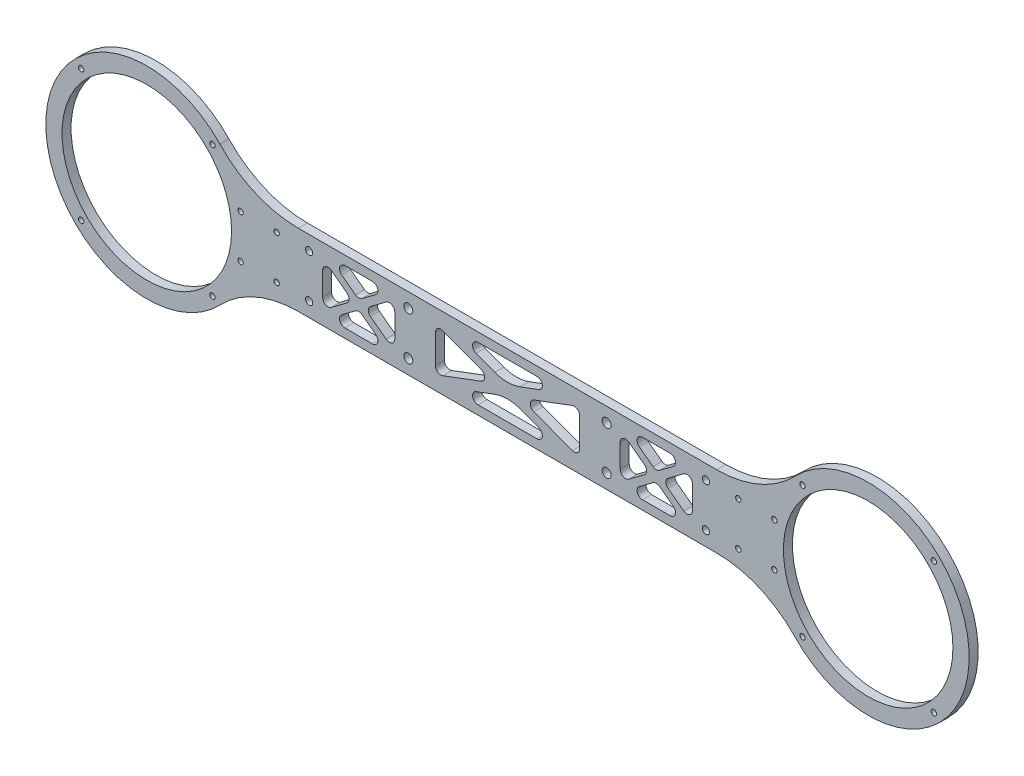
from build123d import *

# Parameters (mm, degrees)
SKETCH_1_R           = 47
EXTRUDE_1_DEPTH      = 5
FILLET_1_R           = 60
SKETCH_31_R          = 1.5
CUT_EXTRUDE_14_DEPTH = 5
SKETCH_35_R          = 2.5
SKETCH_35_R_2        = 2
CUT_EXTRUDE_17_DEPTH = 10
CUT_EXTRUDE_18_DEPTH = 10
FILLET_2_R           = 3
FILLET_3_R           = 20
CUT_EXTRUDE_19_DEPTH = 10
SKETCH_39_R          = 1.5
CUT_EXTRUDE_20_DEPTH = 10
FILLET_4_R           = 3


with BuildPart() as part:
    # 草图1 → 凸台-拉伸1 (new body)
    with BuildSketch(Plane.XY):
        with BuildLine():
            Line((347.693212678, 20), (52.306787322, 20))
            ThreePointArc((52.306787322, 20), (-56, 0), (52.306787322, -20))
            Line((52.306787322, -20), (347.693212678, -20))
            ThreePointArc((347.693212678, -20), (456, 0), (347.693212678, 20))
        make_face()
        Circle(SKETCH_1_R, mode=Mode.SUBTRACT)
        with Locations((400, 0)):
            Circle(SKETCH_1_R, mode=Mode.SUBTRACT)
    extrude(amount=EXTRUDE_1_DEPTH)

    # 圆角1
    fillet_1_edges = [part.edges().sort_by_distance(p)[0] for p in [
        (347.693212678, -20, 2.5),
        (52.306787322, -20, 2.5),
        (52.306787322, 20, 2.5),
        (347.693212678, 20, 2.5),
    ]]
    fillet(fillet_1_edges, radius=FILLET_1_R)

    # 草图31 → 切除-拉伸14 (cut)
    with BuildSketch(Plane.XY.offset(5)):
        with Locations((36.415999231, 36.415999231)):
            Circle(SKETCH_31_R)
        with Locations((36.415999231, -36.415999231)):
            Circle(SKETCH_31_R)
        with Locations((-36.415999231, -36.415999231)):
            Circle(SKETCH_31_R)
        with Locations((-36.415999231, 36.415999231)):
            Circle(SKETCH_31_R)
        with Locations((436.415999231, 36.415999231)):
            Circle(SKETCH_31_R)
        with Locations((436.415999231, -36.415999231)):
            Circle(SKETCH_31_R)
        with Locations((363.584000769, -36.415999231)):
            Circle(SKETCH_31_R)
        with Locations((363.584000769, 36.415999231)):
            Circle(SKETCH_31_R)
    extrude(amount=-CUT_EXTRUDE_14_DEPTH, mode=Mode.SUBTRACT)

    # 草图35 → 切除-拉伸17 (cut)
    with BuildSketch(Plane.XY.offset(5)):
        with Locations((145, 12)):
            Circle(SKETCH_35_R)
        with Locations((255, 12)):
            Circle(SKETCH_35_R)
        with Locations((145, -12)):
            Circle(SKETCH_35_R)
        with Locations((255, -12)):
            Circle(SKETCH_35_R)
        with Locations((90, -12)):
            Circle(SKETCH_35_R_2)
        with Locations((90, 12)):
            Circle(SKETCH_35_R_2)
        with Locations((310, -12)):
            Circle(SKETCH_35_R_2)
        with Locations((310, 12)):
            Circle(SKETCH_35_R_2)
    extrude(amount=-CUT_EXTRUDE_17_DEPTH, mode=Mode.SUBTRACT)

    # 草图37 → 切除-拉伸18 (cut)
    with BuildSketch(Plane(origin=(0, 0, 0), x_dir=(-1, 0, 0), z_dir=(0, 0, -1))):
        Polygon((-232.879996879, 15), (-200, 2.67000117), (-167.120003121, 15), align=None)
        Polygon((-160, 12.32999883), (-192.879996879, 0), (-160, -12.32999883), align=None)
        Polygon((-167.120003121, -15), (-200, -2.67000117), (-232.879996879, -15), align=None)
        Polygon((-240, 12.32999883), (-240, -12.32999883), (-207.120003121, 0), align=None)
    extrude(amount=-CUT_EXTRUDE_18_DEPTH, mode=Mode.SUBTRACT)

    # 圆角2
    fillet_2_edges = [part.edges().sort_by_distance(p)[0] for p in [
        (167.120003121, -15, 2.5),
        (232.879996879, -15, 2.5),
        (192.879996879, 0, 2.5),
        (160, 12.32999883, 2.5),
        (160, -12.32999883, 2.5),
        (240, 12.32999883, 2.5),
        (207.120003121, 0, 2.5),
        (240, -12.32999883, 2.5),
        (232.879996879, 15, 2.5),
        (167.120003121, 15, 2.5),
    ]]
    fillet(fillet_2_edges, radius=FILLET_2_R)

    # 圆角3
    fillet_3_edges = [part.edges().sort_by_distance(p)[0] for p in [
        (200, -2.67000117, 2.5),
        (200, 2.67000117, 2.5),
    ]]
    fillet(fillet_3_edges, radius=FILLET_3_R)

    # 草图38 → 切除-拉伸19 (cut)
    with BuildSketch(Plane(origin=(0, 0, 0), x_dir=(-1, 0, 0), z_dir=(0, 0, -1))):
        Polygon((-302.5, 12.5), (-302.5, -12.5), (-285.833333333, 0), align=None)
        Polygon((-262.5, 12.5), (-279.166666667, 0), (-262.5, -12.5), align=None)
        Polygon((-265.833333333, -15), (-282.5, -2.5), (-299.166666667, -15), align=None)
        Polygon((-299.166666667, 15), (-282.5, 2.5), (-265.833333333, 15), align=None)
        Polygon((-100.833333333, -15), (-117.5, -2.5), (-134.166666667, -15), align=None)
        Polygon((-97.5, 12.5), (-114.166666667, 0), (-97.5, -12.5), align=None)
        Polygon((-117.5, 2.5), (-100.833333333, 15), (-134.166666667, 15), align=None)
        Polygon((-137.5, -12.5), (-120.833333333, 0), (-137.5, 12.5), align=None)
    extrude(amount=-CUT_EXTRUDE_19_DEPTH, mode=Mode.SUBTRACT)

    # 草图39 → 切除-拉伸20 (cut)
    with BuildSketch(Plane.XY.offset(5)):
        with Locations((72.001998462, -12)):
            Circle(SKETCH_39_R)
        with Locations((52, -12)):
            Circle(SKETCH_39_R)
        with Locations((72.001998462, 12)):
            Circle(SKETCH_39_R)
        with Locations((52, 12)):
            Circle(SKETCH_39_R)
        with Locations((348, 12)):
            Circle(SKETCH_39_R)
        with Locations((327.998001538, 12)):
            Circle(SKETCH_39_R)
        with Locations((327.998001538, -12)):
            Circle(SKETCH_39_R)
        with Locations((348, -12)):
            Circle(SKETCH_39_R)
    extrude(amount=-CUT_EXTRUDE_20_DEPTH, mode=Mode.SUBTRACT)

    # 圆角4
    fillet_4_edges = [part.edges().sort_by_distance(p)[0] for p in [
        (100.833333333, -15, 2.5),
        (134.166666667, -15, 2.5),
        (117.5, -2.5, 2.5),
        (299.166666667, 15, 2.5),
        (265.833333333, 15, 2.5),
        (282.5, 2.5, 2.5),
        (279.166666667, 0, 2.5),
        (262.5, 12.5, 2.5),
        (262.5, -12.5, 2.5),
        (282.5, -2.5, 2.5),
        (265.833333333, -15, 2.5),
        (299.166666667, -15, 2.5),
        (137.5, -12.5, 2.5),
        (137.5, 12.5, 2.5),
        (120.833333333, 0, 2.5),
        (97.5, -12.5, 2.5),
        (114.166666667, 0, 2.5),
        (97.5, 12.5, 2.5),
        (117.5, 2.5, 2.5),
        (134.166666667, 15, 2.5),
        (100.833333333, 15, 2.5),
        (302.5, 12.5, 2.5),
        (285.833333333, 0, 2.5),
        (302.5, -12.5, 2.5),
    ]]
    fillet(fillet_4_edges, radius=FILLET_4_R)


solid = part.part
